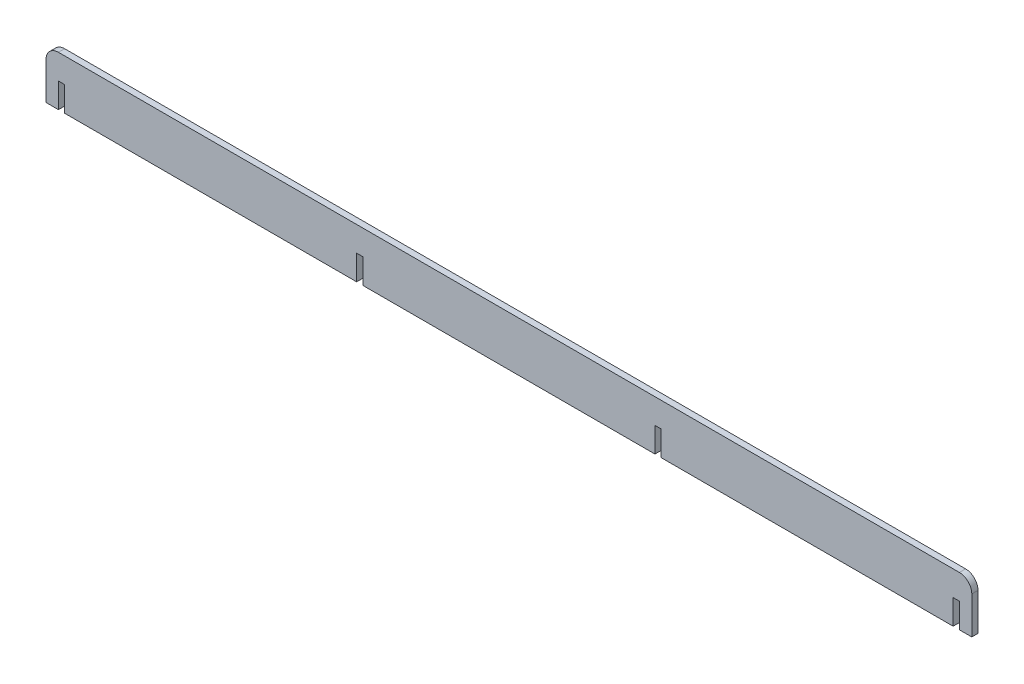
from build123d import *

# Parameters (mm, degrees)
BOSS_EXTRUDE1_DEPTH = 5
FILLET1_R           = 10


with BuildPart() as part:
    # Sketch1 → Boss-Extrude1 (new body)
    with BuildSketch(Plane.XY):
        Polygon((12.5, -225.446883651), (-732.5, -225.446883651), (-732.5, -265.446883651), (-722.5, -265.446883651), (-722.5, -245.446883651), (-717.5, -245.446883651), (-717.5, -265.446883651), (-482.5, -265.446883651), (-482.5, -245.446883651), (-477.5, -245.446883651), (-477.5, -265.446883651), (-242.5, -265.446883651), (-242.5, -245.446883651), (-237.5, -245.446883651), (-237.5, -265.446883651), (-2.5, -265.446883651), (-2.5, -245.446883651), (2.5, -245.446883651), (2.5, -265.446883651), (12.5, -265.446883651), align=None)
    extrude(amount=BOSS_EXTRUDE1_DEPTH)

    # Fillet1
    fillet1_edges = [part.edges().sort_by_distance(p)[0] for p in [
        (-732.5, -225.446883651, 2.5),
        (12.5, -225.446883651, 2.5),
    ]]
    fillet(fillet1_edges, radius=FILLET1_R)


solid = part.part
